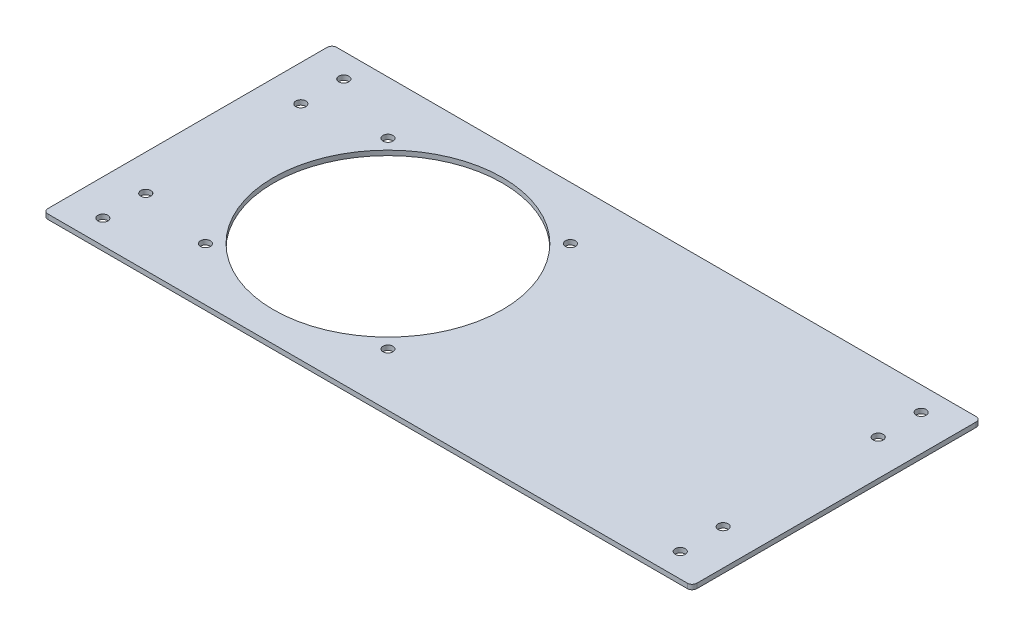
from build123d import *

# Parameters (mm, degrees)
SKETCH_1_W          = 272
SKETCH_1_H          = 121
EXTRUDE_1_DEPTH     = 2
SKETCH_2_R          = 2.1
CUT_EXTRUDE_1_DEPTH = 149.863192227
FILLET_1_R          = 2
SKETCH_3_R          = 2.1
SKETCH_3_R_2        = 2.06
SKETCH_3_R_3        = 48
CUT_EXTRUDE_2_DEPTH = 149.863192227


with BuildPart() as part:
    # 草图1 → 凸台-拉伸1 (new body)
    with BuildSketch(Plane(origin=(0, 0, 0), x_dir=(1, 0, 0), z_dir=(0, 1, 0))):
        Rectangle(SKETCH_1_W, SKETCH_1_H)
    extrude(amount=EXTRUDE_1_DEPTH)

    # 草图2 → 切除-拉伸1 (cut, through all)
    with BuildSketch(Plane(origin=(0, 2, 0), x_dir=(1, 0, 0), z_dir=(0, 1, 0))):
        with Locations(Location((121, 50.5, 0), (0, 0, 270))):
            Circle(SKETCH_2_R)
        with Locations(Location((121, 32.5, 0), (0, 0, 270))):
            Circle(SKETCH_2_R)
        with Locations(Location((121, -32.5, 0), (0, 0, 90))):
            Circle(SKETCH_2_R)
        with Locations(Location((121, -50.5, 0), (0, 0, 90))):
            Circle(SKETCH_2_R)
        with Locations(Location((-121, -50.5, 0), (0, 0, 270))):
            Circle(SKETCH_2_R)
        with Locations(Location((-121, -32.5, 0), (0, 0, 270))):
            Circle(SKETCH_2_R)
        with Locations(Location((-121, 32.5, 0), (0, 0, 90))):
            Circle(SKETCH_2_R)
        with Locations(Location((-121, 50.5, 0), (0, 0, 90))):
            Circle(SKETCH_2_R)
    extrude(amount=-CUT_EXTRUDE_1_DEPTH, mode=Mode.SUBTRACT)

    # 圆角1
    fillet_1_edges = [part.edges().sort_by_distance(p)[0] for p in [
        (136, 1, 60.5),
        (-136, 1, 60.5),
        (-136, 1, -60.5),
        (136, 1, -60.5),
    ]]
    fillet(fillet_1_edges, radius=FILLET_1_R)

    # 草图3 → 切除-拉伸2 (cut, through all)
    with BuildSketch(Plane.XZ):
        with Locations(Location((-13.75, -38.25, 0), (0, 0, 270))):
            Circle(SKETCH_3_R)
        with Locations(Location((-13.75, 38.25, 0), (0, 0, 270))):
            Circle(SKETCH_3_R_2)
        with Locations(Location((-90.25, 38.25, 0), (0, 0, 270))):
            Circle(SKETCH_3_R)
        with Locations(Location((-90.25, -38.25, 0), (0, 0, 270))):
            Circle(SKETCH_3_R)
        with Locations(Location((-52, 0, 0), (0, 0, 270))):
            Circle(SKETCH_3_R_3)
    extrude(amount=-CUT_EXTRUDE_2_DEPTH, mode=Mode.SUBTRACT)


solid = part.part
